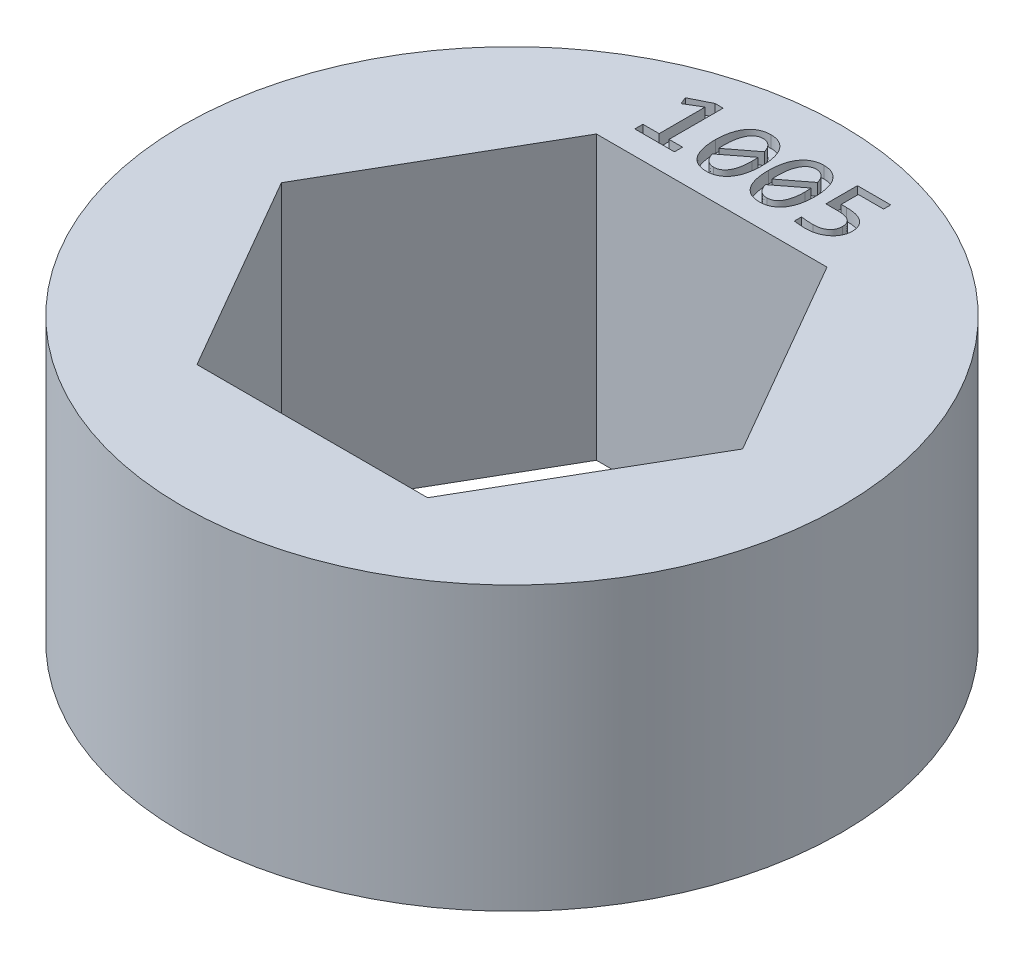
from build123d import *

# Parameters (mm, degrees)
SKETCH1_R           = 11.1125
BOSS_EXTRUDE1_DEPTH = 9.525
CUT_EXTRUDE1_DEPTH  = 0.4


with BuildPart() as part:
    # Sketch1 → Boss-Extrude1 (new body)
    with BuildSketch(Plane(origin=(0, 0, 0), x_dir=(1, 0, 0), z_dir=(0, 1, 0))):
        with Locations(Location((0, 0, 0), (0, 0, 90))):
            Circle(SKETCH1_R)
        Polygon((7.772289324, 0), (3.886144662, 6.731), (-3.886144662, 6.731), (-7.772289324, 0), (-3.886144662, -6.731), (3.886144662, -6.731), align=None, mode=Mode.SUBTRACT)
    extrude(amount=BOSS_EXTRUDE1_DEPTH)

    # Sketch2 → Cut-Extrude1 (cut)
    # profile 1 of 4: a face of its own
    with BuildSketch(Plane(origin=(0, 9.525, 0), x_dir=(1, 0, 0), z_dir=(0, 1, 0))):
        Polygon((-2.049251493, 7.52475), (-3.385828712, 7.52475), (-3.385828712, 7.798140795), (-2.839047122, 7.798140795), (-2.839047122, 9.347355299), (-3.343586037, 9.043587749), (-3.446582222, 9.286601789), (-2.776395065, 9.620746094), (-2.504902817, 9.620746094), (-2.504902817, 7.798140795), (-2.049251493, 7.798140795), align=None)
    # profile 2 of 4: a face of its own
    with BuildSketch(Plane(origin=(0, 9.525, 0), x_dir=(1, 0, 0), z_dir=(0, 1, 0))):
        with BuildLine():
            add(Edge.make_bspline(
                [(-0.165892684, 8.571798773), (-0.166325651, 8.532539667), (-0.167173732, 8.455640449), (-0.177140738, 8.343154692), (-0.192029215, 8.235790499), (-0.213292587, 8.133952321), (-0.240272581, 8.037990717), (-0.274910407, 7.94907057), (-0.314865217, 7.866804514), (-0.36154288, 7.791798506), (-0.414321619, 7.724560589), (-0.47324158, 7.664946723), (-0.538399911, 7.613533187), (-0.609814661, 7.570502981), (-0.68721939, 7.535730504), (-0.771505487, 7.511991642), (-0.861946132, 7.496719325), (-0.924455141, 7.495170599), (-0.956637587, 7.494373245)],
                knots=[0, 0, 0, 0, 1.248871528, 2.446241243, 3.590357027, 4.69618527, 5.754202854, 6.758290001, 7.728669934, 8.660396172, 9.563796911, 10.443071522, 11.321307858, 12.197637495, 13.090115231, 14.012601613, 14.976798049, 16, 16, 16, 16], degree=3))
            add(Edge.make_bspline(
                [(-0.956637587, 7.494373245), (-0.984523883, 7.495052085), (-1.039450838, 7.49638918), (-1.119857224, 7.508449964), (-1.196306294, 7.528578979), (-1.268936867, 7.555832092), (-1.33687734, 7.592268051), (-1.399769911, 7.637185139), (-1.457884215, 7.690364794), (-1.510227055, 7.752740329), (-1.557317942, 7.823677829), (-1.598168065, 7.90395186), (-1.633485499, 7.992818781), (-1.663637227, 8.090645609), (-1.686393921, 8.197912899), (-1.703489664, 8.314242635), (-1.713327632, 8.43999634), (-1.714500293, 8.526849228), (-1.715107188, 8.571798773)],
                knots=[0, 0, 0, 0, 0.897102697, 1.767001224, 2.609309556, 3.43771295, 4.257811968, 5.082953918, 5.919052252, 6.786174452, 7.6970727, 8.653553743, 9.679470751, 10.771494031, 11.944028827, 13.204944144, 14.553456404, 16, 16, 16, 16], degree=3))
            add(Edge.make_bspline(
                [(-1.715107188, 8.571798773), (-1.71439973, 8.61105018), (-1.713011452, 8.688075074), (-1.704182638, 8.80098373), (-1.688450082, 8.908608048), (-1.666850285, 9.010640269), (-1.638993202, 9.106716551), (-1.604965465, 9.195993499), (-1.56504748, 9.278286577), (-1.518887126, 9.353393458), (-1.466343023, 9.420893929), (-1.407260963, 9.480522767), (-1.342058547, 9.532107187), (-1.270210211, 9.574984835), (-1.192479257, 9.609682096), (-1.108222811, 9.633455575), (-1.01826503, 9.648757906), (-0.956228477, 9.650320298), (-0.924362285, 9.651122849)],
                knots=[0, 0, 0, 0, 1.248165713, 2.449334701, 3.598380242, 4.704508407, 5.763215836, 6.776019403, 7.739017366, 8.667464557, 9.574217704, 10.452902578, 11.330549874, 12.210601904, 13.107080692, 14.028948355, 14.987533857, 16, 16, 16, 16], degree=3))
            add(Edge.make_bspline(
                [(-0.924362285, 9.651122849), (-0.896475332, 9.65044401), (-0.841547085, 9.649106917), (-0.761301786, 9.637068879), (-0.684906628, 9.616988523), (-0.612566496, 9.588928446), (-0.544255062, 9.55306767), (-0.481529832, 9.507650243), (-0.423570481, 9.4541749), (-0.371366128, 9.391384812), (-0.324102603, 9.320190323), (-0.282877316, 9.240086592), (-0.247896786, 9.150892646), (-0.21811261, 9.053170973), (-0.194357973, 8.94609034), (-0.177578445, 8.829814678), (-0.16764054, 8.703922163), (-0.166489433, 8.616908067), (-0.165892684, 8.571798773)],
                knots=[0, 0, 0, 0, 0.896490568, 1.765795528, 2.602608418, 3.432274242, 4.256303472, 5.076742829, 5.915718828, 6.786140009, 7.696416714, 8.659101079, 9.677705081, 10.773848187, 11.941709476, 13.20176442, 14.549356535, 16, 16, 16, 16], degree=3))
        make_face()
        with BuildLine():
            add(Edge.make_bspline(
                [(-0.469660234, 8.555661122), (-0.469767537, 8.573863715), (-0.469981394, 8.610141868), (-0.474024404, 8.66420242), (-0.477403908, 8.717562964), (-0.480799232, 8.752800822), (-0.482475427, 8.770196954)],
                knots=[0, 0, 0, 0, 1.015676625, 2.024265076, 3.024624451, 4, 4, 4, 4], degree=3))
            Line((-0.482475427, 8.770196954), (-1.352010038, 8.101908345))
            add(Edge.make_bspline(
                [(-1.352010038, 8.101908345), (-1.34345071, 8.076265996), (-1.326662373, 8.025970882), (-1.294265101, 7.955066462), (-1.254555089, 7.89173888), (-1.206818183, 7.837824622), (-1.151314915, 7.794527876), (-1.099629529, 7.766900506), (-1.054544191, 7.751966897), (-1.018409114, 7.743163446), (-0.979846281, 7.738703342), (-0.953482359, 7.737832032), (-0.940025299, 7.737387285)],
                knots=[0, 0, 0, 0, 1.361870802, 2.671184605, 3.91877896, 5.116024374, 6.280451232, 7.450298556, 8.047911377, 8.670688444, 9.321473259, 10, 10, 10, 10], degree=3))
            add(Edge.make_bspline(
                [(-0.940025299, 7.737387285), (-0.922568023, 7.737990031), (-0.888151282, 7.739178334), (-0.837940335, 7.749690283), (-0.790019018, 7.765595868), (-0.744956902, 7.788922519), (-0.702437868, 7.81819234), (-0.664088949, 7.855043255), (-0.627980083, 7.897005683), (-0.595887758, 7.945833557), (-0.56696193, 8.000716962), (-0.54122657, 8.061797586), (-0.519690508, 8.129212654), (-0.501773845, 8.20284563), (-0.487029219, 8.282354818), (-0.476801204, 8.368116723), (-0.470554024, 8.459848262), (-0.469964364, 8.523058842), (-0.469660234, 8.555661122)],
                knots=[0, 0, 0, 0, 0.796240393, 1.569775284, 2.332781704, 3.095240773, 3.878796528, 4.681173991, 5.516437293, 6.40201063, 7.34239963, 8.345981007, 9.424260963, 10.57011489, 11.804224653, 13.114209461, 14.5115885, 16, 16, 16, 16], degree=3))
        make_face(mode=Mode.SUBTRACT)
        with BuildLine():
            add(Edge.make_bspline(
                [(-1.411339638, 8.575121231), (-1.411359377, 8.558192429), (-1.411398856, 8.524334087), (-1.411104532, 8.473852915), (-1.409430028, 8.424119907), (-1.406576912, 8.391427549), (-1.40516936, 8.375299139)],
                knots=[0, 0, 0, 0, 1.015676347, 2.03139705, 3.028811753, 4, 4, 4, 4], degree=3))
            Line((-1.40516936, 8.375299139), (-0.535160112, 9.043587749))
            add(Edge.make_bspline(
                [(-0.535160112, 9.043587749), (-0.543388282, 9.06962101), (-0.55938939, 9.120247212), (-0.593277284, 9.190237885), (-0.631981209, 9.253403948), (-0.679714875, 9.306455436), (-0.733736714, 9.350825781), (-0.785361246, 9.377733147), (-0.829524865, 9.3935938), (-0.864965959, 9.402303753), (-0.902414282, 9.406781166), (-0.927991087, 9.407661784), (-0.940974573, 9.408108809)],
                knots=[0, 0, 0, 0, 1.387569518, 2.698370158, 3.946895934, 5.144331536, 6.312393877, 7.486406228, 8.084826247, 8.697958228, 9.339048001, 10, 10, 10, 10], degree=3))
            add(Edge.make_bspline(
                [(-0.940974573, 9.408108809), (-0.958425679, 9.407488034), (-0.992830258, 9.406264186), (-1.04303389, 9.396031422), (-1.090739, 9.379139534), (-1.13598574, 9.355773608), (-1.178581811, 9.325843448), (-1.217031274, 9.288351162), (-1.253677288, 9.245695765), (-1.285520627, 9.19530522), (-1.314500544, 9.139278924), (-1.339775267, 9.076800562), (-1.361156549, 9.008131554), (-1.379940417, 8.933425934), (-1.393792523, 8.852471795), (-1.404251708, 8.765520689), (-1.410428728, 8.672353508), (-1.411029772, 8.60819695), (-1.411339638, 8.575121231)],
                knots=[0, 0, 0, 0, 0.786453526, 1.550480632, 2.299704824, 3.062398082, 3.840423392, 4.637837687, 5.478332318, 6.370910143, 7.318703432, 8.320397478, 9.40580758, 10.560070273, 11.791787257, 13.106920475, 14.508481623, 16, 16, 16, 16], degree=3))
        make_face(mode=Mode.SUBTRACT)
    # profile 3 of 4: a face of its own
    with BuildSketch(Plane(origin=(0, 9.525, 0), x_dir=(1, 0, 0), z_dir=(0, 1, 0))):
        with BuildLine():
            add(Edge.make_bspline(
                [(1.62633586, 8.571798773), (1.625902893, 8.532539667), (1.625054812, 8.455640449), (1.615087806, 8.343154692), (1.600199328, 8.235790499), (1.578935957, 8.133952321), (1.551955963, 8.037990717), (1.517318137, 7.94907057), (1.477363327, 7.866804514), (1.430685663, 7.791798506), (1.377906925, 7.724560589), (1.318986964, 7.664946723), (1.253828633, 7.613533187), (1.182413883, 7.570502981), (1.105009154, 7.535730504), (1.020723057, 7.511991642), (0.930282412, 7.496719325), (0.867773403, 7.495170599), (0.835590957, 7.494373245)],
                knots=[0, 0, 0, 0, 1.248871528, 2.446241243, 3.590357027, 4.69618527, 5.754202854, 6.758290001, 7.728669934, 8.660396172, 9.563796911, 10.443071522, 11.321307858, 12.197637495, 13.090115231, 14.012601613, 14.976798049, 16, 16, 16, 16], degree=3))
            add(Edge.make_bspline(
                [(0.835590957, 7.494373245), (0.807704661, 7.495052085), (0.752777706, 7.49638918), (0.67237132, 7.508449964), (0.59592225, 7.528578979), (0.523291677, 7.555832092), (0.455351204, 7.592268051), (0.392458633, 7.637185139), (0.334344328, 7.690364794), (0.282001489, 7.752740329), (0.234910602, 7.823677829), (0.194060479, 7.90395186), (0.158743045, 7.992818781), (0.128591317, 8.090645609), (0.105834623, 8.197912899), (0.08873888, 8.314242635), (0.078900912, 8.43999634), (0.077728251, 8.526849228), (0.077121356, 8.571798773)],
                knots=[0, 0, 0, 0, 0.897102697, 1.767001224, 2.609309556, 3.43771295, 4.257811968, 5.082953918, 5.919052252, 6.786174452, 7.6970727, 8.653553743, 9.679470751, 10.771494031, 11.944028827, 13.204944144, 14.553456404, 16, 16, 16, 16], degree=3))
            add(Edge.make_bspline(
                [(0.077121356, 8.571798773), (0.077828814, 8.61105018), (0.079217092, 8.688075074), (0.088045906, 8.80098373), (0.103778462, 8.908608048), (0.125378259, 9.010640269), (0.153235342, 9.106716551), (0.187263079, 9.195993499), (0.227181064, 9.278286577), (0.273341418, 9.353393458), (0.325885521, 9.420893929), (0.384967581, 9.480522767), (0.450169997, 9.532107187), (0.522018333, 9.574984835), (0.599749287, 9.609682096), (0.684005733, 9.633455575), (0.773963514, 9.648757906), (0.836000067, 9.650320298), (0.867866259, 9.651122849)],
                knots=[0, 0, 0, 0, 1.248165713, 2.449334701, 3.598380242, 4.704508407, 5.763215836, 6.776019403, 7.739017366, 8.667464557, 9.574217704, 10.452902578, 11.330549874, 12.210601904, 13.107080692, 14.028948355, 14.987533857, 16, 16, 16, 16], degree=3))
            add(Edge.make_bspline(
                [(0.867866259, 9.651122849), (0.895753212, 9.65044401), (0.950681459, 9.649106917), (1.030926758, 9.637068879), (1.107321916, 9.616988523), (1.179662048, 9.588928446), (1.247973482, 9.55306767), (1.310698712, 9.507650243), (1.368658063, 9.4541749), (1.420862416, 9.391384812), (1.468125941, 9.320190323), (1.509351228, 9.240086592), (1.544331758, 9.150892646), (1.574115934, 9.053170973), (1.597870571, 8.94609034), (1.614650099, 8.829814678), (1.624588004, 8.703922163), (1.625739111, 8.616908067), (1.62633586, 8.571798773)],
                knots=[0, 0, 0, 0, 0.896490568, 1.765795528, 2.602608418, 3.432274242, 4.256303472, 5.076742829, 5.915718828, 6.786140009, 7.696416714, 8.659101079, 9.677705081, 10.773848187, 11.941709476, 13.20176442, 14.549356535, 16, 16, 16, 16], degree=3))
        make_face()
        with BuildLine():
            add(Edge.make_bspline(
                [(1.32256831, 8.555661122), (1.322461007, 8.573863715), (1.322247149, 8.610141868), (1.31820414, 8.66420242), (1.314824636, 8.717562964), (1.311429311, 8.752800822), (1.309753117, 8.770196954)],
                knots=[0, 0, 0, 0, 1.015676625, 2.024265076, 3.024624451, 4, 4, 4, 4], degree=3))
            Line((1.309753117, 8.770196954), (0.440218505, 8.101908345))
            add(Edge.make_bspline(
                [(0.440218505, 8.101908345), (0.448777834, 8.076265996), (0.465566171, 8.025970882), (0.497963443, 7.955066462), (0.537673455, 7.89173888), (0.585410361, 7.837824622), (0.640913629, 7.794527876), (0.692599015, 7.766900506), (0.737684353, 7.751966897), (0.77381943, 7.743163446), (0.812382263, 7.738703342), (0.838746185, 7.737832032), (0.852203245, 7.737387285)],
                knots=[0, 0, 0, 0, 1.361870802, 2.671184605, 3.91877896, 5.116024374, 6.280451232, 7.450298556, 8.047911377, 8.670688444, 9.321473259, 10, 10, 10, 10], degree=3))
            add(Edge.make_bspline(
                [(0.852203245, 7.737387285), (0.86966052, 7.737990031), (0.904077262, 7.739178334), (0.954288209, 7.749690283), (1.002209526, 7.765595868), (1.047271642, 7.788922519), (1.089790676, 7.81819234), (1.128139595, 7.855043255), (1.164248461, 7.897005683), (1.196340786, 7.945833557), (1.225266614, 8.000716962), (1.251001974, 8.061797586), (1.272538036, 8.129212654), (1.290454699, 8.20284563), (1.305199325, 8.282354818), (1.31542734, 8.368116723), (1.32167452, 8.459848262), (1.32226418, 8.523058842), (1.32256831, 8.555661122)],
                knots=[0, 0, 0, 0, 0.796240393, 1.569775284, 2.332781704, 3.095240773, 3.878796528, 4.681173991, 5.516437293, 6.40201063, 7.34239963, 8.345981007, 9.424260963, 10.57011489, 11.804224653, 13.114209461, 14.5115885, 16, 16, 16, 16], degree=3))
        make_face(mode=Mode.SUBTRACT)
        with BuildLine():
            add(Edge.make_bspline(
                [(0.380888906, 8.575121231), (0.380869167, 8.558192429), (0.380829688, 8.524334087), (0.381124012, 8.473852915), (0.382798516, 8.424119907), (0.385651632, 8.391427549), (0.387059184, 8.375299139)],
                knots=[0, 0, 0, 0, 1.015676347, 2.03139705, 3.028811753, 4, 4, 4, 4], degree=3))
            Line((0.387059184, 8.375299139), (1.257068432, 9.043587749))
            add(Edge.make_bspline(
                [(1.257068432, 9.043587749), (1.248840262, 9.06962101), (1.232839154, 9.120247212), (1.19895126, 9.190237885), (1.160247335, 9.253403948), (1.112513669, 9.306455436), (1.05849183, 9.350825781), (1.006867298, 9.377733147), (0.962703679, 9.3935938), (0.927262585, 9.402303753), (0.889814262, 9.406781166), (0.864237457, 9.407661784), (0.851253971, 9.408108809)],
                knots=[0, 0, 0, 0, 1.387569518, 2.698370158, 3.946895934, 5.144331536, 6.312393877, 7.486406228, 8.084826247, 8.697958228, 9.339048001, 10, 10, 10, 10], degree=3))
            add(Edge.make_bspline(
                [(0.851253971, 9.408108809), (0.833802865, 9.407488034), (0.799398286, 9.406264186), (0.749194653, 9.396031422), (0.701489544, 9.379139534), (0.656242804, 9.355773608), (0.613646733, 9.325843448), (0.57519727, 9.288351162), (0.538551256, 9.245695765), (0.506707917, 9.19530522), (0.477728, 9.139278924), (0.452453277, 9.076800562), (0.431071995, 9.008131554), (0.412288127, 8.933425934), (0.398436021, 8.852471795), (0.387976836, 8.765520689), (0.381799816, 8.672353508), (0.381198772, 8.60819695), (0.380888906, 8.575121231)],
                knots=[0, 0, 0, 0, 0.786453526, 1.550480632, 2.299704824, 3.062398082, 3.840423392, 4.637837687, 5.478332318, 6.370910143, 7.318703432, 8.320397478, 9.40580758, 10.560070273, 11.791787257, 13.106920475, 14.508481623, 16, 16, 16, 16], degree=3))
        make_face(mode=Mode.SUBTRACT)
    # profile 4 of 4: a face of its own
    with BuildSketch(Plane(origin=(0, 9.525, 0), x_dir=(1, 0, 0), z_dir=(0, 1, 0))):
        with BuildLine():
            add(Edge.make_bspline(
                [(3.266680629, 8.201107435), (3.265835224, 8.175430759), (3.264170906, 8.124882014), (3.251716887, 8.050651813), (3.230207044, 7.980102309), (3.200458294, 7.913400854), (3.163954078, 7.85061339), (3.120476188, 7.792475436), (3.070676578, 7.739033862), (3.014949902, 7.689963466), (2.953370677, 7.645972757), (2.885946314, 7.607299943), (2.813684447, 7.573159101), (2.736100793, 7.544858901), (2.654746883, 7.522035501), (2.569645988, 7.50590442), (2.481376433, 7.496358147), (2.421375941, 7.495040733), (2.390975739, 7.494373245)],
                knots=[0, 0, 0, 0, 0.98172717, 1.932690758, 2.868675772, 3.79512682, 4.719778069, 5.640699909, 6.565489728, 7.508663867, 8.475813283, 9.454477684, 10.477621026, 11.528583183, 12.609071962, 13.705570848, 14.837491085, 16, 16, 16, 16], degree=3))
            add(Edge.make_bspline(
                [(2.390975739, 7.494373245), (2.374837067, 7.494449792), (2.341441386, 7.494608191), (2.290311184, 7.496457595), (2.237682142, 7.500268822), (2.184751211, 7.502902497), (2.132627596, 7.508287649), (2.082225989, 7.512440037), (2.035079128, 7.518171545), (2.005087317, 7.522633099), (1.99085692, 7.52475)],
                knots=[0, 0, 0, 0, 0.964491421, 1.995817636, 3.056882487, 4.117947338, 5.162324201, 6.187869467, 7.140187366, 8, 8, 8, 8], degree=3))
            Line((1.99085692, 7.52475), (1.99085692, 7.76776404))
            add(Edge.make_bspline(
                [(1.99085692, 7.76776404), (2.021501805, 7.762800555), (2.086658467, 7.752247274), (2.189593195, 7.743702572), (2.299158369, 7.738615846), (2.373882517, 7.737797831), (2.411385122, 7.737387285)],
                knots=[0, 0, 0, 0, 0.882238515, 1.875801315, 2.933905742, 4, 4, 4, 4], degree=3))
            add(Edge.make_bspline(
                [(2.411385122, 7.737387285), (2.43212105, 7.737756041), (2.472724876, 7.738478116), (2.531965403, 7.743979571), (2.587860425, 7.754265932), (2.640658866, 7.767266407), (2.689920942, 7.784248637), (2.735438235, 7.804893646), (2.777309792, 7.828379589), (2.815102315, 7.855715097), (2.848928611, 7.886041434), (2.878472333, 7.919643569), (2.904556616, 7.955721702), (2.92531423, 7.995510679), (2.941987438, 8.038003316), (2.954383342, 8.082975093), (2.961618569, 8.130626792), (2.96247464, 8.163111577), (2.962913079, 8.179748779)],
                knots=[0, 0, 0, 0, 1.24924794, 2.446200838, 3.579242984, 4.670415696, 5.719433635, 6.713395331, 7.678134183, 8.606690161, 9.517812713, 10.409125339, 11.297783723, 12.193215167, 13.104786339, 14.043608292, 14.99802676, 16, 16, 16, 16], degree=3))
            add(Edge.make_bspline(
                [(2.962913079, 8.179748779), (2.962389316, 8.19574142), (2.961379182, 8.226584945), (2.955538704, 8.271485909), (2.943867298, 8.312576405), (2.928907075, 8.35083318), (2.908558958, 8.385004245), (2.884767999, 8.416677107), (2.85544381, 8.443935454), (2.822295646, 8.468402377), (2.785206516, 8.489773551), (2.743942094, 8.507591501), (2.699269135, 8.52332641), (2.650734154, 8.536196295), (2.598126079, 8.545354492), (2.541912064, 8.552495235), (2.481698191, 8.556809667), (2.440345109, 8.557304174), (2.41897931, 8.557559669)],
                knots=[0, 0, 0, 0, 1.018778499, 1.96482378, 2.874050982, 3.732757355, 4.572520443, 5.398697291, 6.246699149, 7.111119102, 8.018334738, 8.965559426, 9.969232179, 11.032231485, 12.15860358, 13.366965149, 14.639596152, 16, 16, 16, 16], degree=3))
            Line((2.41897931, 8.557559669), (2.021233675, 8.557559669))
            Line((2.021233675, 8.557559669), (2.021233675, 9.620746094))
            Line((2.021233675, 9.620746094), (3.145173609, 9.620746094))
            Line((3.145173609, 9.620746094), (3.145173609, 9.377732054))
            Line((3.145173609, 9.377732054), (2.29462447, 9.377732054))
            Line((2.29462447, 9.377732054), (2.29462447, 8.800573709))
            Line((2.29462447, 8.800573709), (2.476410363, 8.800573709))
            add(Edge.make_bspline(
                [(2.476410363, 8.800573709), (2.50125355, 8.800113719), (2.550508613, 8.799201724), (2.624083886, 8.794790392), (2.696364455, 8.785294439), (2.767487184, 8.773913896), (2.836436066, 8.758156058), (2.901679484, 8.736343506), (2.963133688, 8.709467218), (3.020746824, 8.677960076), (3.073672991, 8.640272455), (3.121693289, 8.596932794), (3.163481539, 8.546953269), (3.200500878, 8.491642263), (3.231020534, 8.429564588), (3.251401051, 8.35956458), (3.264526537, 8.282764079), (3.265944524, 8.229011485), (3.266680629, 8.201107435)],
                knots=[0, 0, 0, 0, 1.059175612, 2.099962526, 3.139743828, 4.165320853, 5.169746916, 6.150783593, 7.093036138, 8.02582832, 8.944668115, 9.856526481, 10.775316774, 11.714305364, 12.688572902, 13.710506815, 14.811478169, 16, 16, 16, 16], degree=3))
        make_face()
    extrude(amount=-CUT_EXTRUDE1_DEPTH, mode=Mode.SUBTRACT)


solid = part.part
